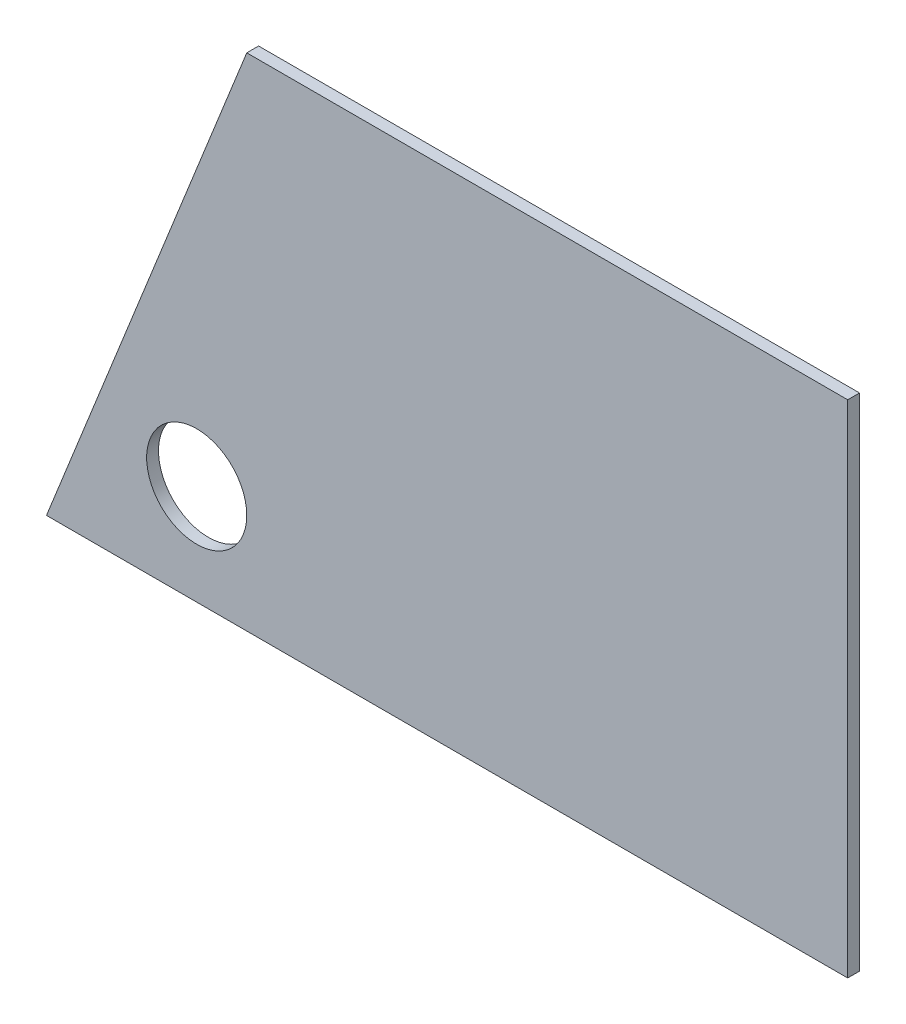
from build123d import *

# Parameters (mm, degrees)
SKETCH2_R           = 12.693936535
BOSS_EXTRUDE1_DEPTH = 3


with BuildPart() as part:
    # Sketch2 → Boss-Extrude1 (new body)
    with BuildSketch(Plane.XY):
        Polygon((0, 0), (203.2, 0), (203.2, 127), (50.8, 127), align=None)
        with Locations((38.1, 25.4)):
            Circle(SKETCH2_R, mode=Mode.SUBTRACT)
    extrude(amount=BOSS_EXTRUDE1_DEPTH)


solid = part.part
